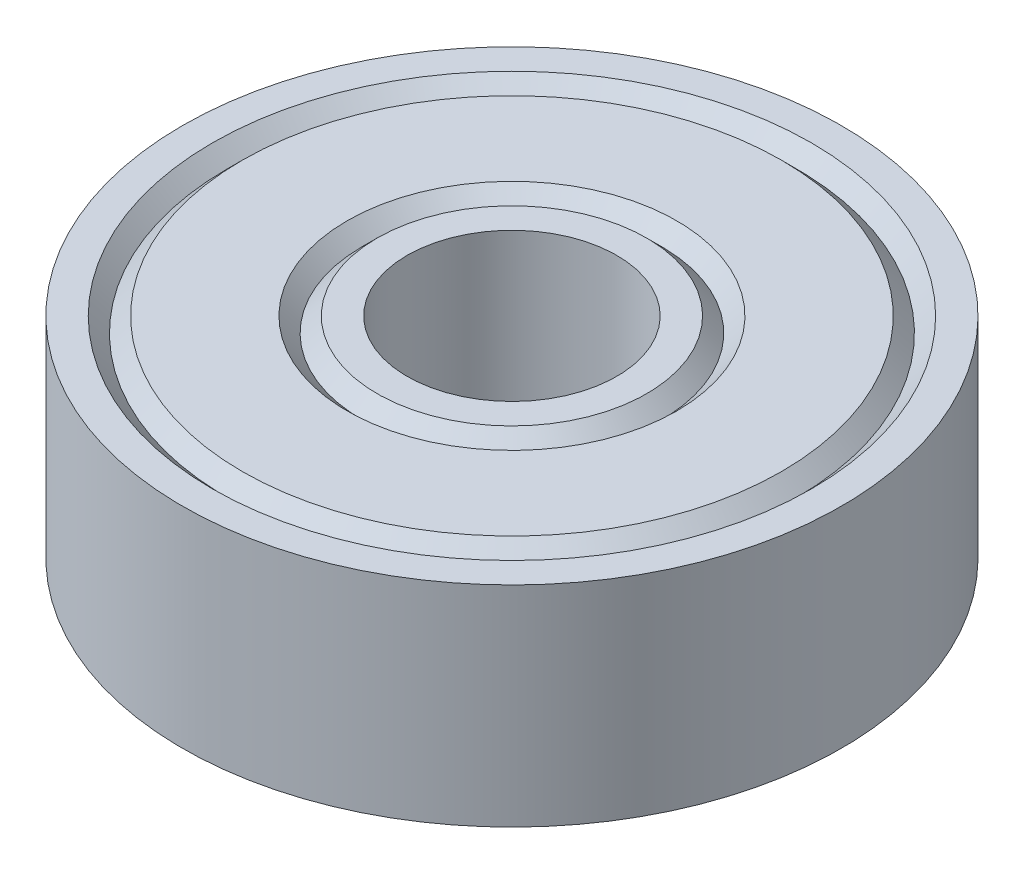
from build123d import *


with BuildPart() as part:
    # Sketch1 → Revolve1 (revolve)
    with BuildSketch(Plane.XY):
        Polygon((-3.5, 3.5), (-4.5, 3.5), (-5, 3), (-5.5, 3.5), (-9, 3.5), (-9.5, 3), (-10, 3.5), (-11, 3.5), (-11, -3.5), (-10, -3.5), (-9.5, -3), (-9, -3.5), (-5.5, -3.5), (-5, -3), (-4.5, -3.5), (-3.5, -3.5), align=None)
    revolve(axis=Axis((0, 3.5, 0), (0, -1, 0)))


solid = part.part
